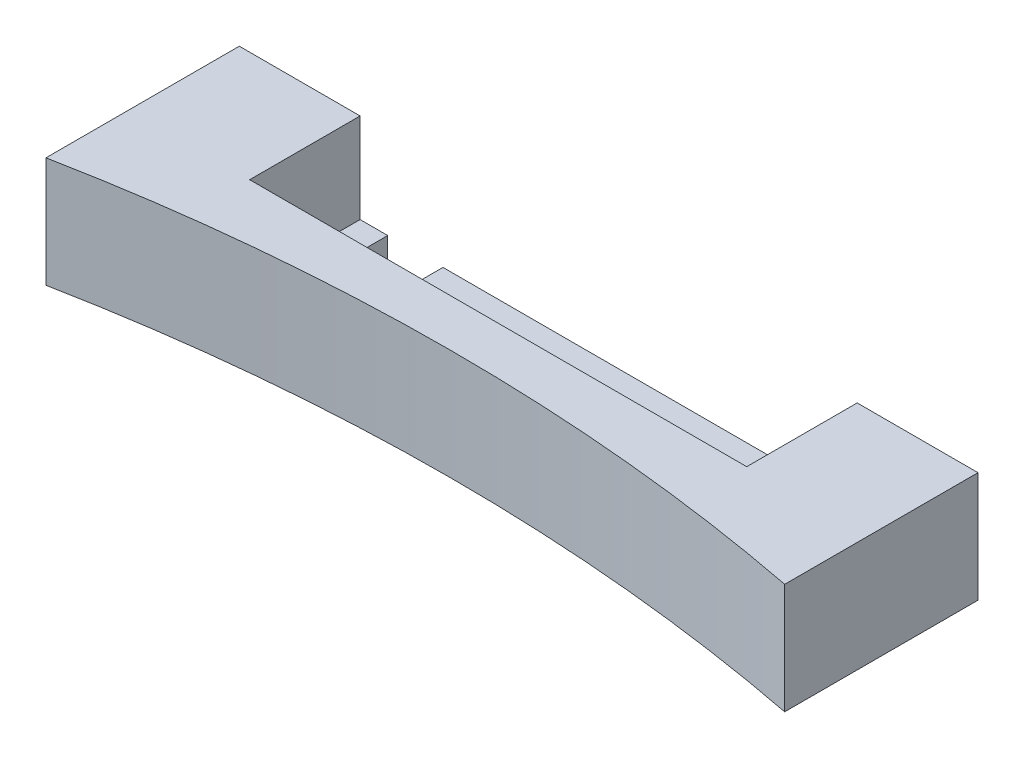
from build123d import *

# Parameters (mm, degrees)
BOSS_EXTRUDE1_DEPTH                                 = 6
SKETCH3_W                                           = 53.5
SKETCH3_H                                           = 8
BOSS_EXTRUDE2_DEPTH                                 = 2
CSK_FOR_M3_COUNTERSUNK_FLAT_HEAD_SCREW1_D           = 3.6
CSK_FOR_M3_COUNTERSUNK_FLAT_HEAD_SCREW1_CSINK_D     = 6.3
CSK_FOR_M3_COUNTERSUNK_FLAT_HEAD_SCREW1_CSINK_ANGLE = 90
CUT_EXTRUDE1_DEPTH                                  = 29.66727228
BOSS_EXTRUDE3_DEPTH                                 = 8
SKETCH8_W                                           = 24
SKETCH8_H                                           = 1.5
BOSS_EXTRUDE4_DEPTH                                 = 2
CSK_FOR_M3_COUNTERSUNK_FLAT_HEAD_SCREW2_D           = 3.6
CSK_FOR_M3_COUNTERSUNK_FLAT_HEAD_SCREW2_CSINK_D     = 6.3
CSK_FOR_M3_COUNTERSUNK_FLAT_HEAD_SCREW2_CSINK_ANGLE = 90


with BuildPart() as part:
    # Sketch1 → Boss-Extrude1 (new body)
    with BuildSketch(Plane.XY):
        Polygon((-18, 0), (-18, 6.5), (-26.75, 6.5), (-26.75, -1.5), (26.75, -1.5), (26.75, 6.5), (18, 6.5), (18, 0), align=None)
    extrude(amount=BOSS_EXTRUDE1_DEPTH)

    # Sketch3 → Boss-Extrude2 (add)
    with BuildSketch(Plane.XY.offset(6)):
        with Locations((0, 2.5)):
            Rectangle(SKETCH3_W, SKETCH3_H)
    extrude(amount=BOSS_EXTRUDE2_DEPTH)

    # CSK for M3 Countersunk Flat Head Screw1 (through all)
    with Locations(Plane(origin=(0, -1.5, 0), x_dir=(-1, 0, 0), z_dir=(0, -1, 0))):
        with Locations((0, -3)):
            CounterSinkHole(CSK_FOR_M3_COUNTERSUNK_FLAT_HEAD_SCREW1_D / 2, CSK_FOR_M3_COUNTERSUNK_FLAT_HEAD_SCREW1_CSINK_D / 2, counter_sink_angle=CSK_FOR_M3_COUNTERSUNK_FLAT_HEAD_SCREW1_CSINK_ANGLE)

    # Sketch6 → Cut-Extrude1 (cut, through all)
    with BuildSketch(Plane(origin=(0, 0, 0), x_dir=(1, 0, 0), z_dir=(0, 1, 0))):
        with BuildLine():
            Line((16, 0), (16, -3))
            ThreePointArc((16, -3), (14, -5), (12, -3))
            Line((12, -3), (12, 0))
            ThreePointArc((12, 0), (14, 2), (16, 0))
        make_face()
        with BuildLine():
            Line((-16, 0), (-16, -3))
            ThreePointArc((-16, -3), (-14, -5), (-12, -3))
            Line((-12, -3), (-12, 0))
            ThreePointArc((-12, 0), (-14, 2), (-16, 0))
        make_face()
    extrude(amount=-CUT_EXTRUDE1_DEPTH, mode=Mode.SUBTRACT)

    # Sketch7 → Boss-Extrude3 (add, through all)
    with BuildSketch(Plane(origin=(0, -1.5, 0), x_dir=(1, 0, 0), z_dir=(0, 1, 0))):
        with BuildLine():
            Line((26.75, -12), (26.75, -8))
            Line((26.75, -8), (-26.75, -8))
            Line((-26.75, -8), (-26.75, -12))
            ThreePointArc((-26.75, -12), (0, -9.420658927), (26.75, -12))
        make_face()
    extrude(amount=BOSS_EXTRUDE3_DEPTH)

    # Sketch8 → Boss-Extrude4 (add)
    with BuildSketch(Plane(origin=(0, 0, 0), x_dir=(-1, 0, 0), z_dir=(0, 0, -1))):
        Polygon((-26.75, 6.5), (-18, 6.5), (-18, 0), (-16, 0), (-16, -1.5), (-26.75, -1.5), align=None)
        with Locations((0, -0.75)):
            Rectangle(SKETCH8_W, SKETCH8_H)
        Polygon((18, 6.5), (26.75, 6.5), (26.75, -1.5), (16, -1.5), (16, 0), (18, 0), align=None)
    extrude(amount=BOSS_EXTRUDE4_DEPTH)

    # CSK for M3 Countersunk Flat Head Screw2 (through all)
    with Locations(Plane(origin=(0, -1.5, 0), x_dir=(-1, 0, 0), z_dir=(0, -1, 0))):
        with Locations((0, -3)):
            CounterSinkHole(CSK_FOR_M3_COUNTERSUNK_FLAT_HEAD_SCREW2_D / 2, CSK_FOR_M3_COUNTERSUNK_FLAT_HEAD_SCREW2_CSINK_D / 2, counter_sink_angle=CSK_FOR_M3_COUNTERSUNK_FLAT_HEAD_SCREW2_CSINK_ANGLE)


solid = part.part
